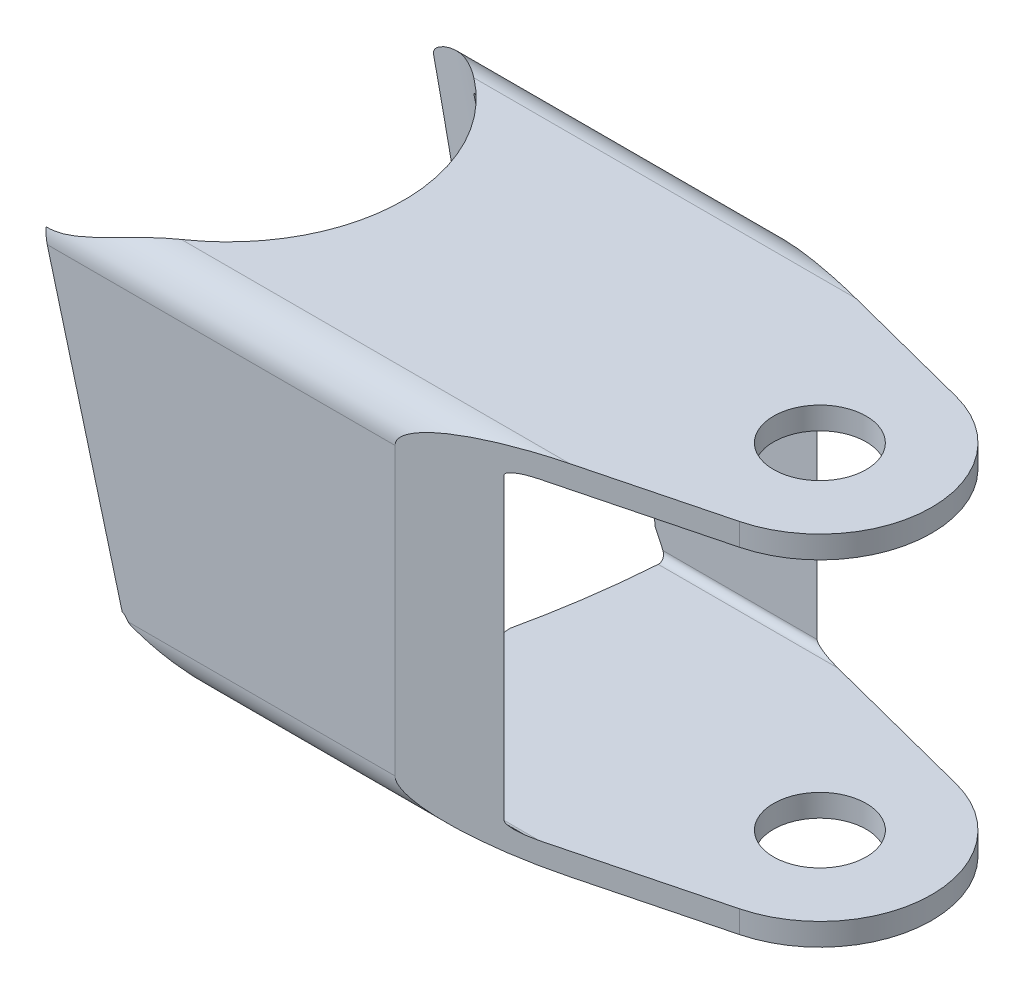
from build123d import *

# Parameters (mm, degrees)
BOSS_EXTRUDE1_DEPTH      = 25.4
BOSS_EXTRUDE1_DEPTH_BACK = 34.925
CUT_EXTRUDE4_DEPTH       = 63.941922635
CUT_EXTRUDE5_DEPTH       = 46.01339384
SKETCH14_R               = 3.2893
CUT_EXTRUDE6_DEPTH       = 46.01339384
CUT_EXTRUDE7_DEPTH       = 38.1
CUT_EXTRUDE7_DEPTH_BACK  = 25.4
SKETCH15_R               = 12.7
CUT_EXTRUDE21_DEPTH      = 14.732
CUT_EXTRUDE21_DEPTH_BACK = 25.4
SKETCH16_R               = 12.7
CUT_EXTRUDE22_DEPTH      = 16.51
CUT_EXTRUDE22_DEPTH_BACK = 12.7
SKETCH17_R               = 12.7
CUT_EXTRUDE23_DEPTH      = 16.51
CUT_EXTRUDE23_DEPTH_BACK = 12.7
SKETCH18_R               = 12.7
CUT_EXTRUDE24_DEPTH      = 12.7
CUT_EXTRUDE24_DEPTH_BACK = 12.7
SKETCH19_R               = 12.7
SKETCH20_W               = 58.413051364
SKETCH20_H               = 40.891520134
CUT_EXTRUDE25_DEPTH      = 51.98499249


with BuildPart() as part:
    # Sketch1 → Boss-Extrude1 (new, two sides: drawn at the far end of the back side and taken through both)
    with BuildSketch(Plane(origin=(0, 0, 0), x_dir=(0, 0, -1), z_dir=(1, 0, 0)).offset(-BOSS_EXTRUDE1_DEPTH_BACK)):
        with BuildLine():
            Line((-10.16, 12.7), (10.16, 12.7))
            ThreePointArc((10.16, 12.7), (11.956051224, 11.956051224), (12.7, 10.16))
            Line((12.7, 10.16), (12.7, -10.16))
            ThreePointArc((12.7, -10.16), (11.956051224, -11.956051224), (10.16, -12.7))
            Line((10.16, -12.7), (-10.16, -12.7))
            ThreePointArc((-10.16, -12.7), (-11.956051224, -11.956051224), (-12.7, -10.16))
            Line((-12.7, -10.16), (-12.7, 10.16))
            ThreePointArc((-12.7, 10.16), (-11.956051224, 11.956051224), (-10.16, 12.7))
        make_face()
    extrude(amount=BOSS_EXTRUDE1_DEPTH + BOSS_EXTRUDE1_DEPTH_BACK)

    # Sketch11 → Cut-Extrude4 (cut, through all)
    with BuildSketch(Plane(origin=(25.4, 0, 0), x_dir=(0, 0, -1), z_dir=(1, 0, 0))):
        with BuildLine():
            Line((-10.6045, 11.1125), (10.6045, 11.1125))
            ThreePointArc((10.6045, 11.1125), (10.963710245, 10.963710245), (11.1125, 10.6045))
            Line((11.1125, 10.6045), (11.1125, -10.6045))
            ThreePointArc((11.1125, -10.6045), (10.963710245, -10.963710245), (10.6045, -11.1125))
            Line((10.6045, -11.1125), (-10.6045, -11.1125))
            ThreePointArc((-10.6045, -11.1125), (-10.963710245, -10.963710245), (-11.1125, -10.6045))
            Line((-11.1125, -10.6045), (-11.1125, 10.6045))
            ThreePointArc((-11.1125, 10.6045), (-10.963710245, 10.963710245), (-10.6045, 11.1125))
        make_face()
    extrude(amount=-CUT_EXTRUDE4_DEPTH, mode=Mode.SUBTRACT)

    # Sketch12 → Cut-Extrude5 (cut, through all)
    with BuildSketch(Plane(origin=(0, 12.7, 0), x_dir=(1, 0, 0), z_dir=(0, 1, 0))):
        with BuildLine():
            Line((50.8, 12.7), (0, 12.7))
            Line((0, 12.7), (19.444424463, 7.686083637))
            ThreePointArc((19.444424463, 7.686083637), (25.4, 0), (19.444424463, -7.686083637))
            Line((19.444424463, -7.686083637), (0, -12.7))
            Line((0, -12.7), (50.8, -12.7))
            Line((50.8, -12.7), (50.8, 12.7))
        make_face()
    extrude(amount=-CUT_EXTRUDE5_DEPTH, mode=Mode.SUBTRACT)

    # Sketch14 → Cut-Extrude6 (cut, through all)
    with BuildSketch(Plane(origin=(0, 12.7, 0), x_dir=(1, 0, 0), z_dir=(0, 1, 0))):
        with Locations((17.4625, 0)):
            Circle(SKETCH14_R)
    extrude(amount=-CUT_EXTRUDE6_DEPTH, mode=Mode.SUBTRACT)

    # Sketch15 → Cut-Extrude7 (cut, two sides: drawn at the far end of the back side and taken through both)
    with BuildSketch(Plane(origin=(-18.580944095, -12.7, 0.022320862), x_dir=(0.966128643141705, 0.25805311522873825, -0.0020086368292127157), z_dir=(-0.2580609325356477, 0.9660993767043436, -0.007519935525706381)).offset(-CUT_EXTRUDE7_DEPTH_BACK)):
        Circle(SKETCH15_R)
    extrude(amount=CUT_EXTRUDE7_DEPTH + CUT_EXTRUDE7_DEPTH_BACK, mode=Mode.SUBTRACT)

    # Sketch16 → Cut-Extrude21 (cut, two sides: drawn at the far end of the back side and taken through both)
    with BuildSketch(Plane(origin=(-34.925, -13.993557422, 0), x_dir=(0, 0, -1), z_dir=(0.9661266940476224, 0.2580682294444863, 0)).offset(-CUT_EXTRUDE21_DEPTH_BACK)):
        Circle(SKETCH16_R)
    extrude(amount=CUT_EXTRUDE21_DEPTH + CUT_EXTRUDE21_DEPTH_BACK, mode=Mode.SUBTRACT)

    # Sketch17 → Cut-Extrude22 (cut, two sides: drawn at the far end of the back side and taken through both)
    with BuildSketch(Plane(origin=(-29.427114325, -12.623836713, -12.7), x_dir=(0.7903344181486555, -0.13152541034589554, -0.5983916559603502), z_dir=(0.6126756952006717, 0.1696640808045107, 0.7719084092009455)).offset(-CUT_EXTRUDE22_DEPTH_BACK)):
        Circle(SKETCH17_R)
    extrude(amount=CUT_EXTRUDE22_DEPTH + CUT_EXTRUDE22_DEPTH_BACK, mode=Mode.SUBTRACT)


with BuildPart() as cut_extrude22_piece_1:
    # of the separate pieces the step leaves, piece 1, a body of its own (cut_extrude22_pieces)
    add(part.part.solids().sort_by_distance((-34.925, 10.16, 12.7))[0])


with BuildPart() as cut_extrude22_piece_2:
    # of the separate pieces the step leaves, piece 2, a body of its own (cut_extrude22_pieces)
    add(part.part.solids().sort_by_distance((-28.657579441, 0.553532164, -11.1125))[0])


with BuildPart() as cut_extrude23_tool:
    # Sketch18 → Cut-Extrude23 (new, two sides: drawn at the far end of the back side and taken through both)
    with BuildSketch(Plane(origin=(-17.958929348, -9.56049708, -12.7), x_dir=(0.9940833845942288, -0.002324974713650623, 0.10859474649477009), z_dir=(-0.10861963208224606, -0.02127809391484378, 0.9938556324968274)).offset(-CUT_EXTRUDE23_DEPTH_BACK)):
        Circle(SKETCH18_R)
    extrude(amount=CUT_EXTRUDE23_DEPTH + CUT_EXTRUDE23_DEPTH_BACK)


with BuildPart() as cut_extrude22_piece_1_1:
    add(cut_extrude22_piece_1.part)

    # Cut-Extrude23: cut by cut_extrude23_tool
    add(cut_extrude23_tool.part, mode=Mode.SUBTRACT)

    # Sketch19 → Cut-Extrude24 (cut, two sides: drawn at the far end of the back side and taken through both)
    with BuildSketch(Plane(origin=(-16.211316351, -16.081156217, -12.7), x_dir=(0.9763290145154149, 0.09548845507502933, 0.1940711476823458), z_dir=(-0.21629067343590844, 0.43103175814295297, 0.8760308031438372)).offset(-CUT_EXTRUDE24_DEPTH_BACK)):
        Circle(SKETCH19_R)
    extrude(amount=CUT_EXTRUDE24_DEPTH + CUT_EXTRUDE24_DEPTH_BACK, mode=Mode.SUBTRACT)


with BuildPart() as cut_extrude22_piece_2_1:
    add(cut_extrude22_piece_2.part)

    # Cut-Extrude23: cut by cut_extrude23_tool
    add(cut_extrude23_tool.part, mode=Mode.SUBTRACT)


with BuildPart() as cut_extrude25_tool:
    # Sketch20 → Cut-Extrude25 (new, through all)
    with BuildSketch(Plane(origin=(-20.509915766, -5.478533696, 0), x_dir=(0.25806093253564766, -0.9660993767043435, 0.007519935525706381), z_dir=(0.9661266940476224, 0.2580682294444864, 0))):
        Rectangle(SKETCH20_W, SKETCH20_H)
    extrude(amount=-CUT_EXTRUDE25_DEPTH)


with BuildPart() as cut_extrude22_piece_1_2:
    add(cut_extrude22_piece_1_1.part)

    # Cut-Extrude25: cut by cut_extrude25_tool
    add(cut_extrude25_tool.part, mode=Mode.SUBTRACT)


with BuildPart() as cut_extrude22_piece_2_2:
    add(cut_extrude22_piece_2_1.part)

    # Cut-Extrude25: cut by cut_extrude25_tool
    add(cut_extrude25_tool.part, mode=Mode.SUBTRACT)


solid = cut_extrude22_piece_1_2.part
